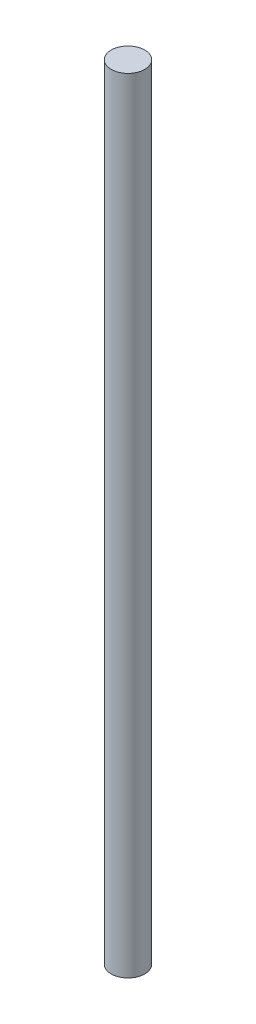
from build123d import *

# Parameters (mm, degrees)
SKETCH2_R           = 3
BOSS_EXTRUDE1_DEPTH = 140


with BuildPart() as part:
    # Sketch2 → Boss-Extrude1 (new body)
    with BuildSketch(Plane(origin=(0, 0, 0), x_dir=(1, 0, 0), z_dir=(0, 1, 0))):
        with Locations(Location((0, 0, 0), (0, 0, 270))):
            Circle(SKETCH2_R)
    extrude(amount=BOSS_EXTRUDE1_DEPTH)


solid = part.part
